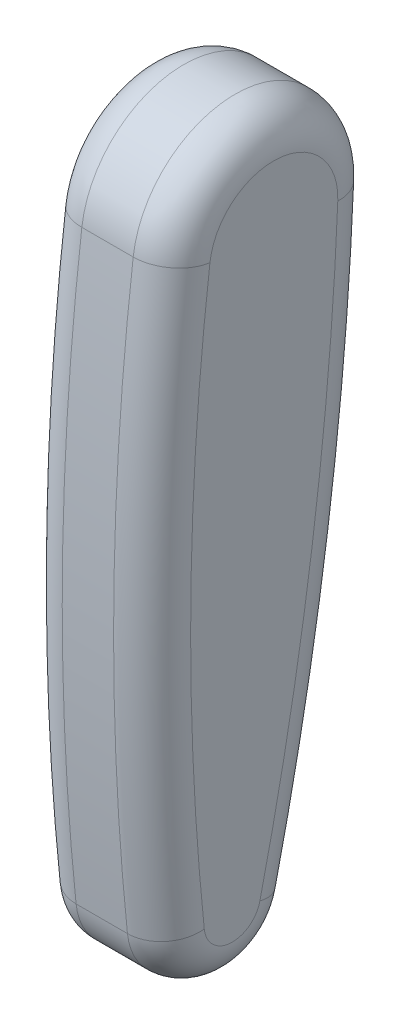
from build123d import *

# Parameters (mm, degrees)
BASE_EXTRUDE_DEPTH = 31.75
FILLET1_R          = 19.05


with BuildPart() as part:
    # Sketch5 → Base-Extrude (new, symmetric)
    with BuildSketch(Plane.ZY.offset(-254)):
        with BuildLine():
            ThreePointArc((9.918396921, -78.230607992), (-44.703978299, -33.86975469), (-91.248408889, -86.643850244))
            ThreePointArc((-91.248408889, -86.643850244), (-78.432247724, -229.591476611), (-52.225916685, -370.69961275))
            ThreePointArc((-52.225916685, -370.69961275), (-17.988619307, -396.10195786), (12.760925504, -366.573375727))
            ThreePointArc((12.760925504, -366.573375727), (19.549821807, -222.321054799), (9.918396921, -78.230607992))
        make_face()
    extrude(amount=BASE_EXTRUDE_DEPTH, both=True)

    # Fillet1
    fillet1_edges = [part.edges().sort_by_distance(p)[0] for p in [
        (285.75, -229.591476611, -78.432247724),
        (222.25, -229.591476611, -78.432247724),
        (285.75, -33.86975469, -44.703978299),
        (222.25, -33.86975469, -44.703978299),
        (285.75, -222.321054799, 19.549821807),
        (222.25, -222.321054799, 19.549821807),
        (222.25, -396.10195786, -17.988619307),
        (285.75, -396.10195786, -17.988619307),
    ]]
    fillet(fillet1_edges, radius=FILLET1_R)


solid = part.part
